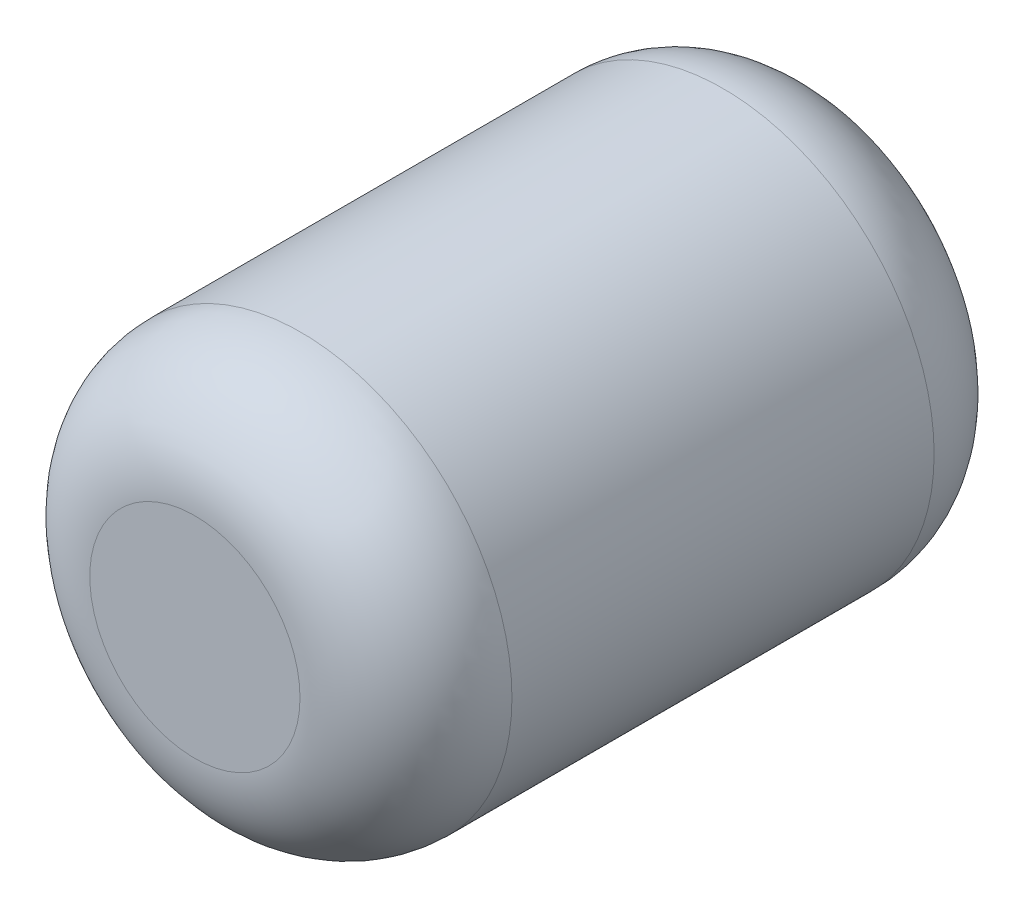
from build123d import *

# Parameters (mm, degrees)
ESQUISSE1_R        = 50.5968
BOSS_EXTRU_1_DEPTH = 151.9936
CONG_1_R           = 25.4


with BuildPart() as part:
    # Esquisse1 → Boss.-Extru.1 (new body)
    with BuildSketch(Plane.XY):
        Circle(ESQUISSE1_R)
    extrude(amount=BOSS_EXTRU_1_DEPTH)

    # Congé1
    cong_1_edges = [part.edges().sort_by_distance(p)[0] for p in [
        (-50.5968, 0, 0),
        (-50.5968, 0, 151.9936),
    ]]
    fillet(cong_1_edges, radius=CONG_1_R)


solid = part.part
